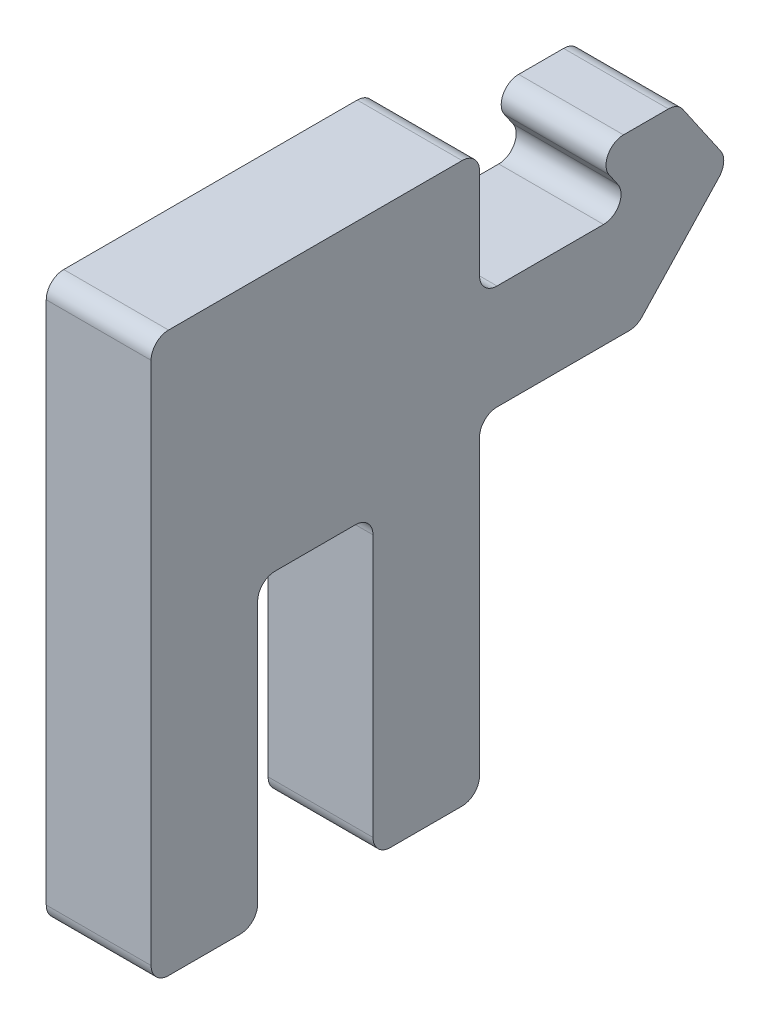
from build123d import *

# Parameters (mm, degrees)
CROQUIS1_W              = 9.4
CROQUIS1_H              = 16
SALIENTE_EXTRUIR1_DEPTH = 3
CROQUIS2_W              = 3.3
CROQUIS2_H              = 8.5
CORTAR_EXTRUIR1_DEPTH   = 3
SALIENTE_EXTRUIR2_DEPTH = 3
REDONDEO1_R             = 0.5


with BuildPart() as part:
    # Croquis1 → Saliente-Extruir1 (new body)
    with BuildSketch(Plane(origin=(0, 0, 0), x_dir=(0, 0, -1), z_dir=(1, 0, 0))):
        Rectangle(CROQUIS1_W, CROQUIS1_H)
    extrude(amount=SALIENTE_EXTRUIR1_DEPTH)

    # Croquis2 → Cortar-Extruir1 (cut)
    with BuildSketch(Plane(origin=(3, 0, 0), x_dir=(0, 0, -1), z_dir=(1, 0, 0))):
        with Locations((0, -3.75)):
            Rectangle(CROQUIS2_W, CROQUIS2_H)
    extrude(amount=-CORTAR_EXTRUIR1_DEPTH, mode=Mode.SUBTRACT)

    # Croquis4 → Saliente-Extruir2 (add)
    with BuildSketch(Plane(origin=(3, 0, 0), x_dir=(0, 0, -1), z_dir=(1, 0, 0))):
        Polygon((4.7, 4.391798286), (4.7, 1.391798286), (9.2, 1.391798286), (11.82874383, 4.204558046), (10.369105711, 6.327401467), (7.869105711, 6.327401467), (9.2, 4.391798286), align=None)
    extrude(amount=-SALIENTE_EXTRUIR2_DEPTH)

    # Redondeo1
    redondeo1_edges = [part.edges().sort_by_distance(p)[0] for p in [
        (1.5, -8, 1.65),
        (1.5, 0.5, 1.65),
        (1.5, 0.5, -1.65),
        (1.5, -8, -1.65),
        (1.5, 4.391798286, -4.7),
        (1.5, 4.391798286, -9.2),
        (1.5, 6.327401467, -7.869105711),
        (1.5, 6.327401467, -10.369105711),
        (1.5, 4.204558046, -11.82874383),
        (1.5, 1.391798286, -9.2),
        (1.5, 1.391798286, -4.7),
        (1.5, 8, 4.7),
        (1.5, 8, -4.7),
        (1.5, -8, -4.7),
        (1.5, -8, 4.7),
    ]]
    fillet(redondeo1_edges, radius=REDONDEO1_R)


solid = part.part
